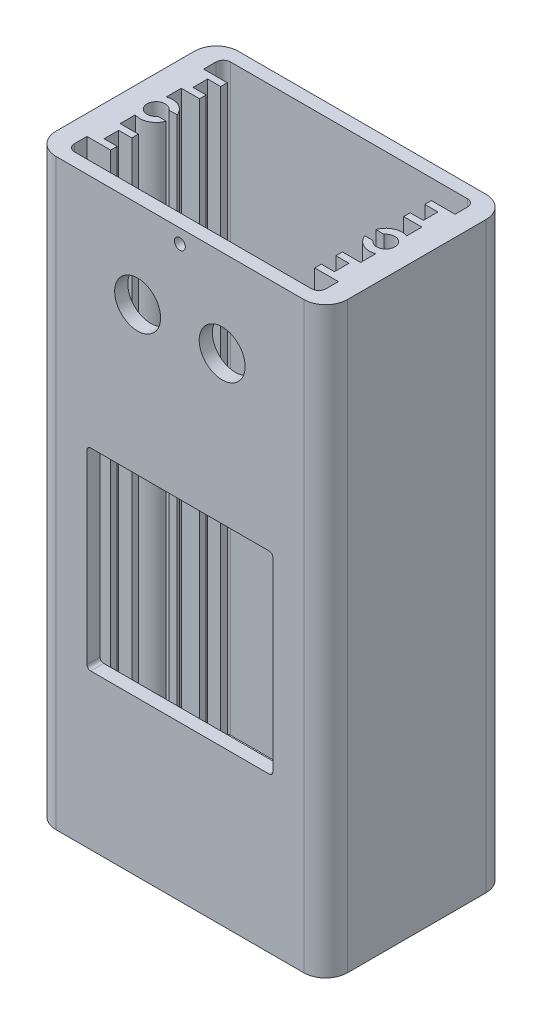
from build123d import *

# Parameters (mm, degrees)
EXTRUDE_1_DEPTH     = 80
CUT_EXTRUDE_1_REACH = 88.168
CUT_EXTRUDE_2_REACH = 88.168
SKETCH_3_R          = 3.15
CUT_EXTRUDE_3_REACH = 88.168
SKETCH_4_R          = 0.75


with BuildPart() as part:
    # 草图1 → 凸台-拉伸1 (new body)
    with BuildSketch(Plane(origin=(0, 0, 0), x_dir=(1, 0, 0), z_dir=(0, 1, 0))):
        with BuildLine():
            Line((-17, 12.5), (17, 12.5))
            ThreePointArc((17, 12.5), (19.121320344, 11.621320344), (20, 9.5))
            Line((20, 9.5), (20, -9.5))
            ThreePointArc((20, -9.5), (19.121320344, -11.621320344), (17, -12.5))
            Line((17, -12.5), (-17, -12.5))
            ThreePointArc((-17, -12.5), (-19.121320344, -11.621320344), (-20, -9.5))
            Line((-20, -9.5), (-20, 9.5))
            ThreePointArc((-20, 9.5), (-19.121320344, 11.621320344), (-17, 12.5))
        make_face()
        with BuildLine():
            Line((-17.25, 8), (-14, 8))
            Line((-14, 8), (-14, 7.1))
            Line((-14, 7.1), (-15.8, 7.1))
            Line((-15.8, 7.1), (-15.8, 5.1))
            Line((-15.8, 5.1), (-14, 5.1))
            Line((-14, 5.1), (-14, 4.2))
            Line((-14, 4.2), (-16.5, 4.2))
            Line((-16.5, 4.2), (-16.5, 2.121320344))
            ThreePointArc((-16.5, 2.121320344), (-14.780330086, 2.030330086), (-13.628679656, 0.75))
            Line((-13.628679656, 0.75), (-14.75, 0.75))
            ThreePointArc((-14.75, 0.75), (-17, 0), (-14.75, -0.75))
            Line((-14.75, -0.75), (-13.628679656, -0.75))
            ThreePointArc((-13.628679656, -0.75), (-14.780330086, -2.030330086), (-16.5, -2.121320344))
            Line((-16.5, -2.121320344), (-16.5, -4.2))
            Line((-16.5, -4.2), (-14, -4.2))
            Line((-14, -4.2), (-14, -5.1))
            Line((-14, -5.1), (-15.8, -5.1))
            Line((-15.8, -5.1), (-15.8, -7.1))
            Line((-15.8, -7.1), (-14, -7.1))
            Line((-14, -7.1), (-14, -8))
            Line((-14, -8), (-17.25, -8))
            Line((-17.25, -8), (-17.25, -9.7))
            ThreePointArc((-17.25, -9.7), (-16.957106781, -10.407106781), (-16.25, -10.7))
            Line((-16.25, -10.7), (16.25, -10.7))
            ThreePointArc((16.25, -10.7), (16.957106781, -10.407106781), (17.25, -9.7))
            Line((17.25, -9.7), (17.25, -8))
            Line((17.25, -8), (14, -8))
            Line((14, -8), (14, -7.1))
            Line((14, -7.1), (15.8, -7.1))
            Line((15.8, -7.1), (15.8, -5.1))
            Line((15.8, -5.1), (14, -5.1))
            Line((14, -5.1), (14, -4.2))
            Line((14, -4.2), (16.5, -4.2))
            Line((16.5, -4.2), (16.5, -2.121320344))
            ThreePointArc((16.5, -2.121320344), (14.780330086, -2.030330086), (13.628679656, -0.75))
            Line((13.628679656, -0.75), (14.75, -0.75))
            ThreePointArc((14.75, -0.75), (17, 0), (14.75, 0.75))
            Line((14.75, 0.75), (13.628679656, 0.75))
            ThreePointArc((13.628679656, 0.75), (14.780330086, 2.030330086), (16.5, 2.121320344))
            Line((16.5, 2.121320344), (16.5, 4.2))
            Line((16.5, 4.2), (14, 4.2))
            Line((14, 4.2), (14, 5.1))
            Line((14, 5.1), (15.8, 5.1))
            Line((15.8, 5.1), (15.8, 7.1))
            Line((15.8, 7.1), (14, 7.1))
            Line((14, 7.1), (14, 8))
            Line((14, 8), (17.25, 8))
            Line((17.25, 8), (17.25, 9.7))
            ThreePointArc((17.25, 9.7), (16.957106781, 10.407106781), (16.25, 10.7))
            Line((16.25, 10.7), (-16.25, 10.7))
            ThreePointArc((-16.25, 10.7), (-16.957106781, 10.407106781), (-17.25, 9.7))
            Line((-17.25, 9.7), (-17.25, 8))
        make_face(mode=Mode.SUBTRACT)
    extrude(amount=EXTRUDE_1_DEPTH)

    # 草图2 → 切除-拉伸1 (cut, up to next)
    with BuildSketch(Plane.XY.offset(12.5), mode=Mode.PRIVATE) as cut_extrude_1_sk1:
        with BuildLine():
            Line((-12.25, 47.74), (12.25, 47.74))
            ThreePointArc((12.25, 47.74), (12.603553391, 47.593553391), (12.75, 47.24))
            Line((12.75, 47.24), (12.75, 21.74))
            ThreePointArc((12.75, 21.74), (12.603553391, 21.386446609), (12.25, 21.24))
            Line((12.25, 21.24), (-12.25, 21.24))
            ThreePointArc((-12.25, 21.24), (-12.603553391, 21.386446609), (-12.75, 21.74))
            Line((-12.75, 21.74), (-12.75, 47.24))
            ThreePointArc((-12.75, 47.24), (-12.603553391, 47.593553391), (-12.25, 47.74))
        make_face()
    cut_extrude_1_tool1 = extrude(cut_extrude_1_sk1.sketch, amount=-CUT_EXTRUDE_1_REACH, mode=Mode.PRIVATE) & part.part
    add(cut_extrude_1_tool1.solids().sort_by_distance((0, 34.49, 12.5))[0], mode=Mode.SUBTRACT)

    # 草图3 → 切除-拉伸2 (cut, up to next)
    with BuildSketch(Plane.XY.offset(12.5), mode=Mode.PRIVATE) as cut_extrude_2_sk1:
        with Locations((-5.8, 68)):
            Circle(SKETCH_3_R)
    cut_extrude_2_tool1 = extrude(cut_extrude_2_sk1.sketch, amount=-CUT_EXTRUDE_2_REACH, mode=Mode.PRIVATE) & part.part
    # 草图3 → 切除-拉伸2 (cut, up to next)
    with BuildSketch(Plane.XY.offset(12.5), mode=Mode.PRIVATE) as cut_extrude_2_sk2:
        with Locations((5.8, 68)):
            Circle(SKETCH_3_R)
    cut_extrude_2_tool2 = extrude(cut_extrude_2_sk2.sketch, amount=-CUT_EXTRUDE_2_REACH, mode=Mode.PRIVATE) & part.part
    add(cut_extrude_2_tool1.solids().sort_by_distance((-5.8, 68, 12.5))[0], mode=Mode.SUBTRACT)
    add(cut_extrude_2_tool2.solids().sort_by_distance((5.8, 68, 12.5))[0], mode=Mode.SUBTRACT)

    # 草图4 → 切除-拉伸3 (cut, up to next)
    with BuildSketch(Plane.XY.offset(12.5), mode=Mode.PRIVATE) as cut_extrude_3_sk1:
        with Locations((0, 78.1)):
            Circle(SKETCH_4_R)
    cut_extrude_3_tool1 = extrude(cut_extrude_3_sk1.sketch, amount=-CUT_EXTRUDE_3_REACH, mode=Mode.PRIVATE) & part.part
    add(cut_extrude_3_tool1.solids().sort_by_distance((0, 78.1, 12.5))[0], mode=Mode.SUBTRACT)


solid = part.part
